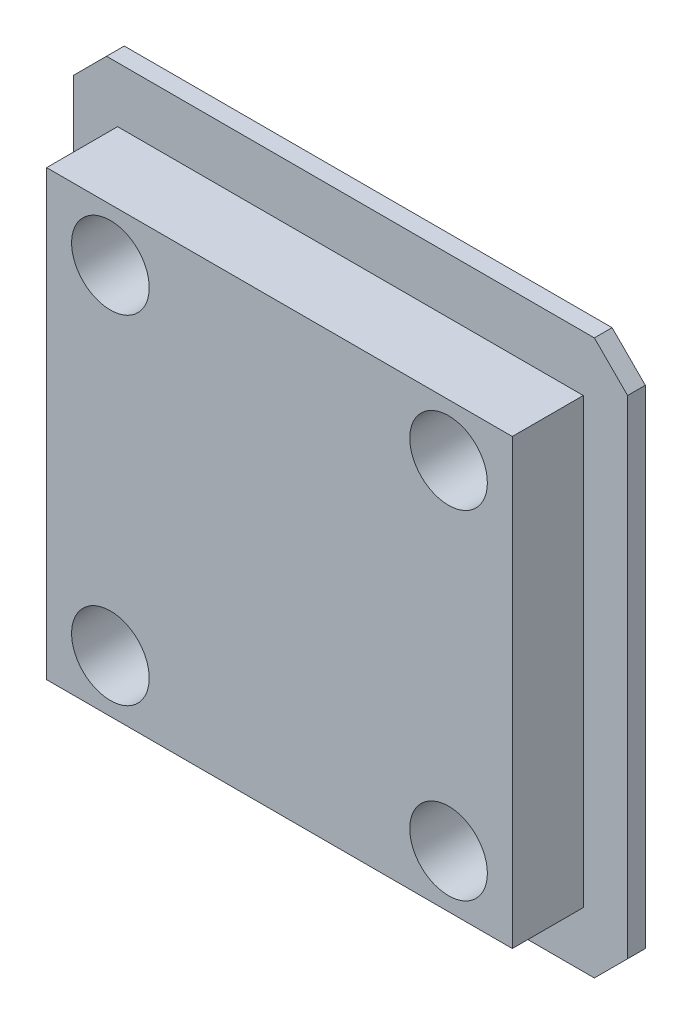
from build123d import *

# Parameters (mm, degrees)
SKETCH_1_R            = 1.65
EXTRUDE_241_DEPTH     = 1.6
EXTRUDE_START         = 1.6
SKETCH_2_W            = 42
SKETCH_2_H            = 40
EXTRUDE_307_DEPTH     = 6.4
CUT_EXTRUDE_START     = 1.6
SKETCH_3_R            = 3.5
CUT_EXTRUDE_391_DEPTH = 6.4


with BuildPart() as part:
    # 草图1 → Extrude 241 (new body)
    with BuildSketch(Plane.XY):
        Polygon((-22, -25), (22, -25), (25, -22), (25, 22), (22, 25), (-22, 25), (-25, 22), (-25, -22), align=None)
        with Locations((-15.25, -15.25)):
            Circle(SKETCH_1_R, mode=Mode.SUBTRACT)
        with Locations((-15.25, 15.25)):
            Circle(SKETCH_1_R, mode=Mode.SUBTRACT)
        with Locations((15.25, -15.25)):
            Circle(SKETCH_1_R, mode=Mode.SUBTRACT)
        with Locations((15.25, 15.25)):
            Circle(SKETCH_1_R, mode=Mode.SUBTRACT)
    extrude(amount=EXTRUDE_241_DEPTH)

    # 草图2 → Extrude 307 (add)
    with BuildSketch(Plane.XY.offset(EXTRUDE_START)):
        Rectangle(SKETCH_2_W, SKETCH_2_H)
    extrude(amount=EXTRUDE_307_DEPTH)

    # 草图3 → Cut-Extrude 391 (cut)
    with BuildSketch(Plane.XY.offset(CUT_EXTRUDE_START)):
        with Locations((-15.25, -15.25)):
            Circle(SKETCH_3_R)
        with Locations((-15.25, 15.25)):
            Circle(SKETCH_3_R)
        with Locations((15.25, -15.25)):
            Circle(SKETCH_3_R)
        with Locations((15.25, 15.25)):
            Circle(SKETCH_3_R)
    extrude(amount=CUT_EXTRUDE_391_DEPTH, mode=Mode.SUBTRACT)


solid = part.part
